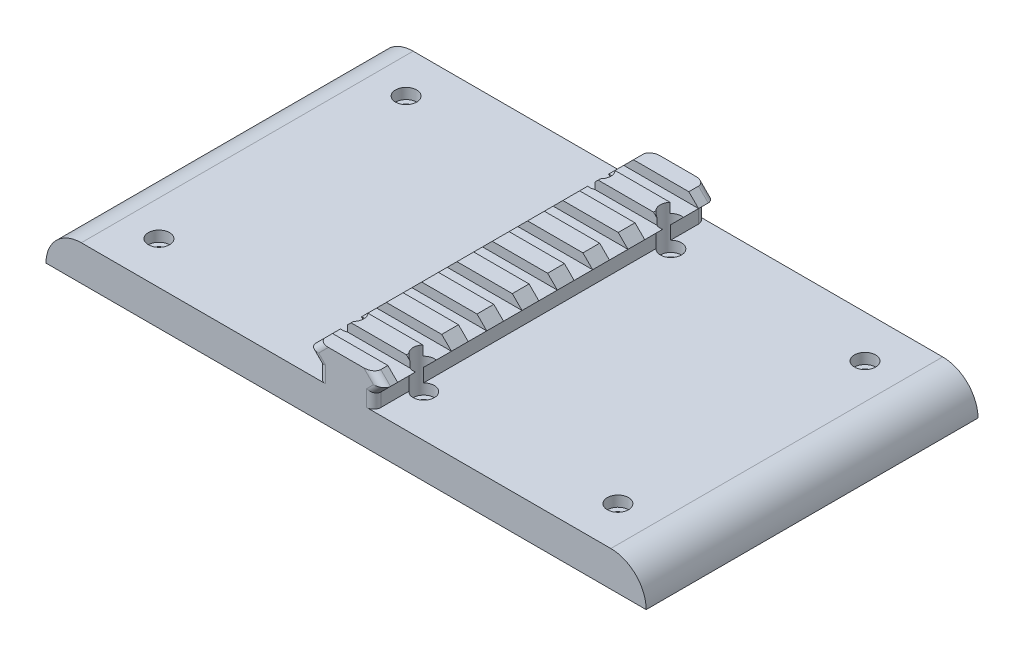
from build123d import *

# Parameters (mm, degrees)
EXTRUDE_1_DEPTH        = 94
EXTRUDE_2_DEPTH        = 94
SKETCH_4_R             = 1.5
CUT_EXTRUDE_1_DEPTH    = 128.125921826
CUT_EXTRUDE_START      = -3
SKETCH_5_R             = 3
CUT_EXTRUDE_2_DEPTH    = 131.125921826
SKETCH_6_W             = 21.2
SKETCH_6_H             = 5.25
CUT_EXTRUDE_3_DEPTH    = 2.76
PATTERN_LINEAR_1_COUNT = 9
PATTERN_LINEAR_1_PITCH = 10
FILLET_2_R             = 2


with BuildPart() as part:
    # 草图3 → 凸台-拉伸1 (new body)
    with BuildSketch(Plane.XY):
        with BuildLine():
            Line((0, 0), (-75, 0))
            ThreePointArc((-75, 0), (-82.071067812, -2.928932188), (-85, -10))
            Line((-85, -10), (-75, -10))
            Line((-75, -10), (0, -10))
            Line((0, -10), (0, 0))
        make_face()
        with BuildLine():
            Line((75, 0), (0, 0))
            Line((0, 0), (0, -10))
            Line((0, -10), (75, -10))
            Line((75, -10), (85, -10))
            ThreePointArc((85, -10), (82.071067812, -2.928932188), (75, 0))
        make_face()
    extrude(amount=EXTRUDE_1_DEPTH)

    # 草图2 → 凸台-拉伸2 (add, through all)
    with BuildSketch(Plane.XY):
        Polygon((7.84, 9.32), (10.6, 6.56), (7.84, 3.8), (7.84, 0), (-7.84, 0), (-7.84, 3.8), (-10.6, 6.56), (-7.84, 9.32), align=None)
    extrude(amount=EXTRUDE_2_DEPTH)

    # 草图4 → 切除-拉伸1 (cut, through all)
    with BuildSketch(Plane(origin=(0, 0, 0), x_dir=(1, 0, 0), z_dir=(0, 1, 0))):
        with Locations(Location((-65, -12, 0), (0, 0, 180))):
            Circle(SKETCH_4_R)
        with Locations(Location((-10, -12, 0), (0, 0, 180))):
            Circle(SKETCH_4_R)
        with Locations((10, -12)):
            Circle(SKETCH_4_R)
        with Locations((65, -12)):
            Circle(SKETCH_4_R)
        with Locations(Location((65, -82, 0), (0, 0, 180))):
            Circle(SKETCH_4_R)
        with Locations(Location((10, -82, 0), (0, 0, 180))):
            Circle(SKETCH_4_R)
        with Locations((-65, -82)):
            Circle(SKETCH_4_R)
        with Locations((-10, -82)):
            Circle(SKETCH_4_R)
    extrude(amount=-CUT_EXTRUDE_1_DEPTH, mode=Mode.SUBTRACT)

    # 草图5 → 切除-拉伸2 (cut, through all)
    with BuildSketch(Plane(origin=(0, 0, 0), x_dir=(1, 0, 0), z_dir=(0, 1, 0)).offset(CUT_EXTRUDE_START)):
        with Locations(Location((-65, -12, 0), (0, 0, 180))):
            Circle(SKETCH_5_R)
        with Locations(Location((-10, -12, 0), (0, 0, 43.945519562))):
            Circle(SKETCH_5_R)
        with Locations((10, -12)):
            Circle(SKETCH_5_R)
        with Locations((65, -12)):
            Circle(SKETCH_5_R)
        with Locations(Location((65, -82, 0), (0, 0, 180))):
            Circle(SKETCH_5_R)
        with Locations(Location((10, -82, 0), (0, 0, 281.536959033))):
            Circle(SKETCH_5_R)
        with Locations((-10, -82)):
            Circle(SKETCH_5_R)
        with Locations((-65, -82)):
            Circle(SKETCH_5_R)
    extrude(amount=CUT_EXTRUDE_2_DEPTH, mode=Mode.SUBTRACT)

    # 草图6 → 切除-拉伸3 (cut)
    with BuildSketch(Plane(origin=(0, 9.32, 0), x_dir=(1, 0, 0), z_dir=(0, 1, 0))):
        with Locations((0, -7.375)):
            Rectangle(SKETCH_6_W, SKETCH_6_H)
    cut_extrude_3 = extrude(amount=-CUT_EXTRUDE_3_DEPTH, mode=Mode.SUBTRACT)

    # 阵列(线性)1: 切除-拉伸3 ×9
    with Locations(*[(0, 0, i * PATTERN_LINEAR_1_PITCH) for i in range(1, PATTERN_LINEAR_1_COUNT)]):
        add(cut_extrude_3, mode=Mode.SUBTRACT)

    # 圆角2
    fillet_2_edges = [part.edges().sort_by_distance(p)[0] for p in [
        (-9.22, 7.94, 0),
        (-9.22, 5.18, 0),
        (-7.84, 1.9, 0),
        (7.84, 1.9, 0),
        (9.22, 5.18, 0),
        (9.22, 7.94, 0),
        (-9.22, 7.94, 94),
        (-9.22, 5.18, 94),
        (-7.84, 1.9, 94),
        (7.84, 1.9, 94),
        (9.22, 5.18, 94),
        (9.22, 7.94, 94),
    ]]
    fillet(fillet_2_edges, radius=FILLET_2_R)


solid = part.part
